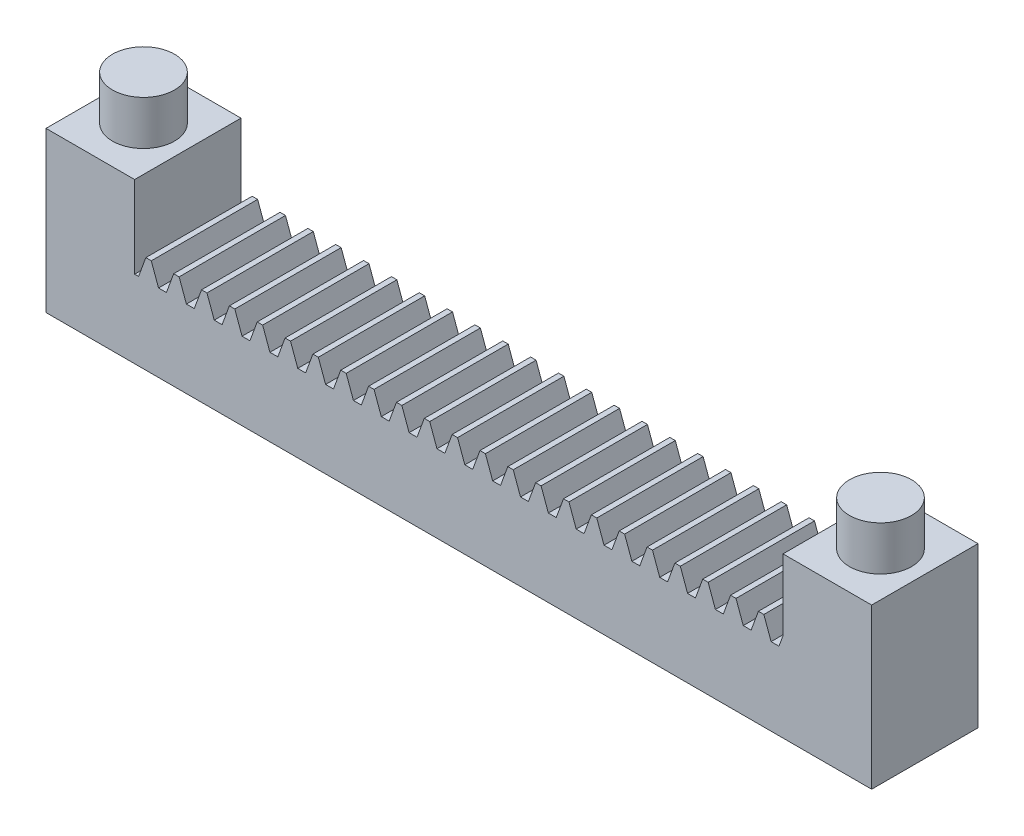
from build123d import *

# Parameters (mm, degrees)
BLANKSKE_W          = 73.1567043
BLANKSKE_H          = 11
BLANK_DEPTH         = 12
TOOTHCUTSIM_DEPTH   = 75.946003122
TEETHCUTS_COUNT     = 24
TEETHCUTS_PITCH     = 3.14159265
SKETCH1_W           = 12
SKETCH1_H           = 8.75
BOSS_EXTRUDE1_DEPTH = 10
SKETCH3_W           = 10
SKETCH3_H           = 8.75
BOSS_EXTRUDE2_DEPTH = 12
SKETCH4_W           = 10
SKETCH4_H           = 9.25
BOSS_EXTRUDE3_DEPTH = 12
SKETCH6_R           = 3.5
BOSS_EXTRUDE5_DEPTH = 5


with BuildPart() as part:
    # BlankSke → Blank (new body)
    with BuildSketch(Plane.XY):
        with Locations((36.57835215, 5.5)):
            Rectangle(BLANKSKE_W, BLANKSKE_H)
    extrude(amount=-BLANK_DEPTH)

    # TooCutSkeSim → ToothCutSim (cut, through all)
    with BuildSketch(Plane.XY):
        Polygon((0.44443537, 8.75), (-0.44443537, 8.75), (-1.272613241, 11.0254), (1.272613241, 11.0254), align=None)
    toothcutsim = extrude(amount=-TOOTHCUTSIM_DEPTH, mode=Mode.SUBTRACT)

    # TeethCuts: ToothCutSim ×24
    with Locations(*[(i * TEETHCUTS_PITCH, 0, 0) for i in range(1, TEETHCUTS_COUNT)]):
        add(toothcutsim, mode=Mode.SUBTRACT)

    # Sketch1 → Boss-Extrude1 (add)
    with BuildSketch(Plane.ZY):
        with Locations((-6, 4.375)):
            Rectangle(SKETCH1_W, SKETCH1_H)
    extrude(amount=BOSS_EXTRUDE1_DEPTH)

    # Sketch3 → Boss-Extrude2 (add, through all)
    with BuildSketch(Plane.XY):
        with Locations((78.1567043, 4.375)):
            Rectangle(SKETCH3_W, SKETCH3_H)
    extrude(amount=-BOSS_EXTRUDE2_DEPTH)

    # Sketch4 → Boss-Extrude3 (add, through all)
    with BuildSketch(Plane(origin=(0, 0, -12), x_dir=(-1, 0, 0), z_dir=(0, 0, -1))):
        with Locations((-78.1567043, 13.375)):
            Rectangle(SKETCH4_W, SKETCH4_H)
        with Locations((5, 13.375)):
            Rectangle(SKETCH4_W, SKETCH4_H)
    extrude(amount=-BOSS_EXTRUDE3_DEPTH)

    # Sketch6 → Boss-Extrude5 (add)
    with BuildSketch(Plane(origin=(0, 18, 0), x_dir=(1, 0, 0), z_dir=(0, 1, 0))):
        with Locations(Location((-5, 6, 0), (0, 0, 270))):
            Circle(SKETCH6_R)
        with Locations(Location((78.1567043, 6, 0), (0, 0, 270))):
            Circle(SKETCH6_R)
    extrude(amount=BOSS_EXTRUDE5_DEPTH)


solid = part.part
